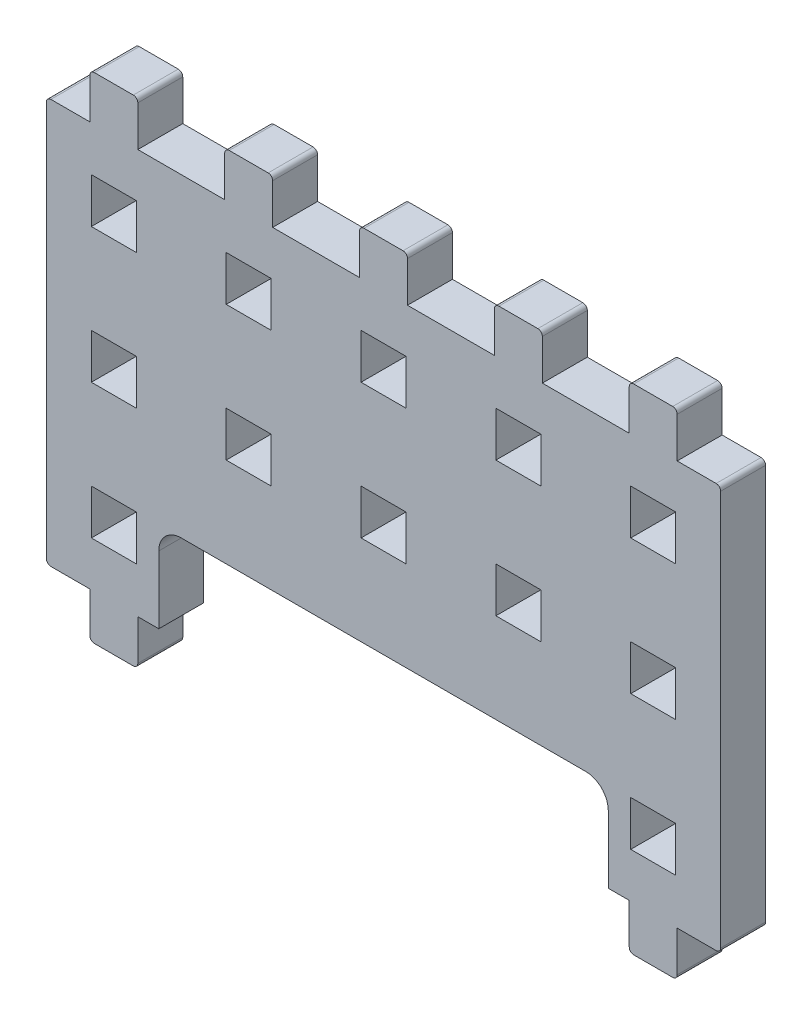
from build123d import *

# Parameters (mm, degrees)
MODEL_W                 = 3
MODEL_H                 = 3
SALIENTE_EXTRUIR1_DEPTH = 3


with BuildPart() as part:
    # Model → Saliente-Extruir1 (new body)
    with BuildSketch(Plane.XY):
        with BuildLine():
            Line((9.478716471, 295.822349433), (9.478716471, 269.422349433))
            ThreePointArc((9.478716471, 269.422349433), (9.566584436, 269.210217399), (9.778716471, 269.122349433))
            Line((9.778716471, 269.122349433), (12.378716471, 269.122349433))
            Line((12.378716471, 269.122349433), (12.378716471, 266.422349433))
            ThreePointArc((12.378716471, 266.422349433), (12.466584436, 266.210217399), (12.678716471, 266.122349433))
            Line((12.678716471, 266.122349433), (15.278716471, 266.122349433))
            ThreePointArc((15.278716471, 266.122349433), (15.490848505, 266.210217399), (15.578716471, 266.422349433))
            Line((15.578716471, 266.422349433), (15.578716471, 269.122349433))
            Line((15.578716471, 269.122349433), (16.978716471, 269.122349433))
            Line((16.978716471, 269.122349433), (16.978716471, 273.622349433))
            ThreePointArc((16.978716471, 273.622349433), (17.418056299, 274.683009605), (18.478716471, 275.122349433))
            Line((18.478716471, 275.122349433), (45.478716471, 275.122349433))
            ThreePointArc((45.478716471, 275.122349433), (46.539376642, 274.683009605), (46.978716471, 273.622349433))
            Line((46.978716471, 273.622349433), (46.978716471, 269.122349433))
            Line((46.978716471, 269.122349433), (48.378716471, 269.122349433))
            Line((48.378716471, 269.122349433), (48.378716471, 266.422349433))
            ThreePointArc((48.378716471, 266.422349433), (48.466584436, 266.210217399), (48.678716471, 266.122349433))
            Line((48.678716471, 266.122349433), (51.278716471, 266.122349433))
            ThreePointArc((51.278716471, 266.122349433), (51.490848505, 266.210217399), (51.578716471, 266.422349433))
            Line((51.578716471, 266.422349433), (51.578716471, 269.122349433))
            Line((51.578716471, 269.122349433), (54.178716471, 269.122349433))
            ThreePointArc((54.178716471, 269.122349433), (54.390848505, 269.210217399), (54.478716471, 269.422349433))
            Line((54.478716471, 269.422349433), (54.478716471, 295.822349433))
            ThreePointArc((54.478716471, 295.822349433), (54.390848505, 296.034481468), (54.178716471, 296.122349433))
            Line((54.178716471, 296.122349433), (51.578716471, 296.122349433))
            Line((51.578716471, 296.122349433), (51.578716471, 298.822349433))
            ThreePointArc((51.578716471, 298.822349433), (51.490848505, 299.034481468), (51.278716471, 299.122349433))
            Line((51.278716471, 299.122349433), (48.678716471, 299.122349433))
            ThreePointArc((48.678716471, 299.122349433), (48.466584436, 299.034481468), (48.378716471, 298.822349433))
            Line((48.378716471, 298.822349433), (48.378716471, 296.122349433))
            Line((48.378716471, 296.122349433), (42.578716471, 296.122349433))
            Line((42.578716471, 296.122349433), (42.578716471, 298.822349433))
            ThreePointArc((42.578716471, 298.822349433), (42.490848505, 299.034481468), (42.278716471, 299.122349433))
            Line((42.278716471, 299.122349433), (39.678716471, 299.122349433))
            ThreePointArc((39.678716471, 299.122349433), (39.466584436, 299.034481468), (39.378716471, 298.822349433))
            Line((39.378716471, 298.822349433), (39.378716471, 296.122349433))
            Line((39.378716471, 296.122349433), (33.578716471, 296.122349433))
            Line((33.578716471, 296.122349433), (33.578716471, 298.822349433))
            ThreePointArc((33.578716471, 298.822349433), (33.490848505, 299.034481468), (33.278716471, 299.122349433))
            Line((33.278716471, 299.122349433), (30.678716471, 299.122349433))
            ThreePointArc((30.678716471, 299.122349433), (30.466584436, 299.034481468), (30.378716471, 298.822349433))
            Line((30.378716471, 298.822349433), (30.378716471, 296.122349433))
            Line((30.378716471, 296.122349433), (24.578716471, 296.122349433))
            Line((24.578716471, 296.122349433), (24.578716471, 298.822349433))
            ThreePointArc((24.578716471, 298.822349433), (24.490848505, 299.034481468), (24.278716471, 299.122349433))
            Line((24.278716471, 299.122349433), (21.678716471, 299.122349433))
            ThreePointArc((21.678716471, 299.122349433), (21.466584436, 299.034481468), (21.378716471, 298.822349433))
            Line((21.378716471, 298.822349433), (21.378716471, 296.122349433))
            Line((21.378716471, 296.122349433), (15.578716471, 296.122349433))
            Line((15.578716471, 296.122349433), (15.578716471, 298.822349433))
            ThreePointArc((15.578716471, 298.822349433), (15.490848505, 299.034481468), (15.278716471, 299.122349433))
            Line((15.278716471, 299.122349433), (12.678716471, 299.122349433))
            ThreePointArc((12.678716471, 299.122349433), (12.466584436, 299.034481468), (12.378716471, 298.822349433))
            Line((12.378716471, 298.822349433), (12.378716471, 296.122349433))
            Line((12.378716471, 296.122349433), (9.778716471, 296.122349433))
            ThreePointArc((9.778716471, 296.122349433), (9.566584436, 296.034481468), (9.478716471, 295.822349433))
        make_face()
        with Locations((13.978716471, 291.622349433)):
            Rectangle(MODEL_W, MODEL_H, mode=Mode.SUBTRACT)
        with Locations((22.978716471, 291.622349433)):
            Rectangle(MODEL_W, MODEL_H, mode=Mode.SUBTRACT)
        with Locations((31.978716471, 291.622349433)):
            Rectangle(MODEL_W, MODEL_H, mode=Mode.SUBTRACT)
        with Locations((13.978716471, 273.622349433)):
            Rectangle(MODEL_W, MODEL_H, mode=Mode.SUBTRACT)
        with Locations((13.978716471, 282.622349433)):
            Rectangle(MODEL_W, MODEL_H, mode=Mode.SUBTRACT)
        with Locations((22.978716471, 282.622349433)):
            Rectangle(MODEL_W, MODEL_H, mode=Mode.SUBTRACT)
        with Locations((31.978716471, 282.622349433)):
            Rectangle(MODEL_W, MODEL_H, mode=Mode.SUBTRACT)
        with Locations((49.978716471, 291.622349433)):
            Rectangle(MODEL_W, MODEL_H, mode=Mode.SUBTRACT)
        with Locations((49.978716471, 273.622349433)):
            Rectangle(MODEL_W, MODEL_H, mode=Mode.SUBTRACT)
        with Locations((49.978716471, 282.622349433)):
            Rectangle(MODEL_W, MODEL_H, mode=Mode.SUBTRACT)
        with Locations((40.978716471, 291.622349433)):
            Rectangle(MODEL_W, MODEL_H, mode=Mode.SUBTRACT)
        with Locations((40.978716471, 282.622349433)):
            Rectangle(MODEL_W, MODEL_H, mode=Mode.SUBTRACT)
    extrude(amount=SALIENTE_EXTRUIR1_DEPTH)


solid = part.part
